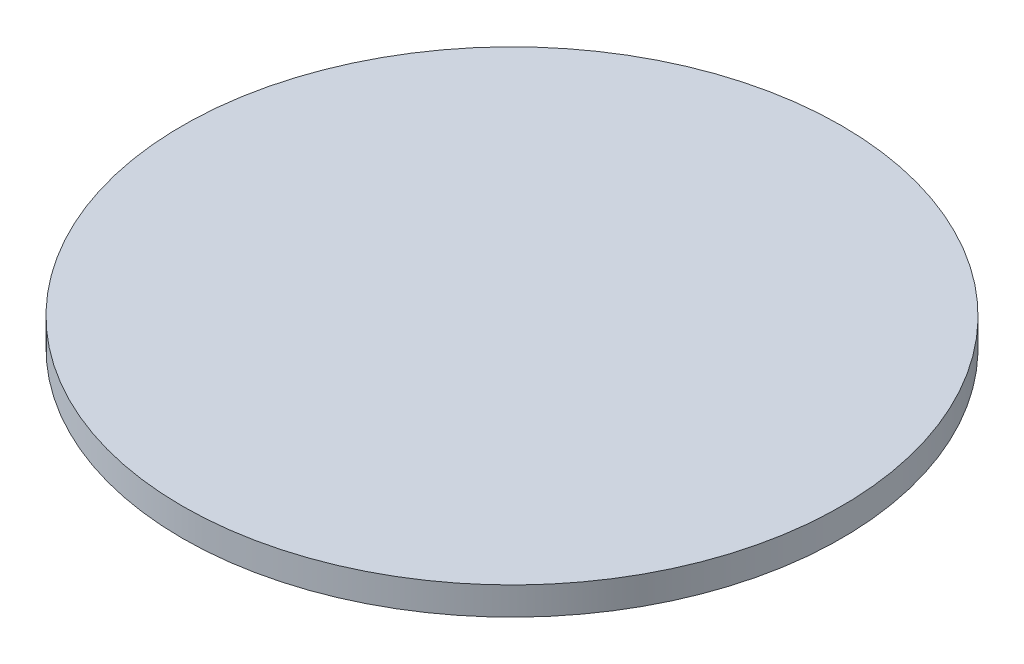
from build123d import *

# Parameters (mm, degrees)
SKETCH1_R           = 6
BOSS_EXTRUDE1_DEPTH = 0.254


with BuildPart() as part:
    # Sketch1 → Boss-Extrude1 (new, symmetric)
    with BuildSketch(Plane(origin=(0, 0, 0), x_dir=(1, 0, 0), z_dir=(0, 1, 0))):
        with Locations(Location((0, 0, 0), (0, 0, 270))):
            Circle(SKETCH1_R)
    extrude(amount=BOSS_EXTRUDE1_DEPTH, both=True)


solid = part.part
